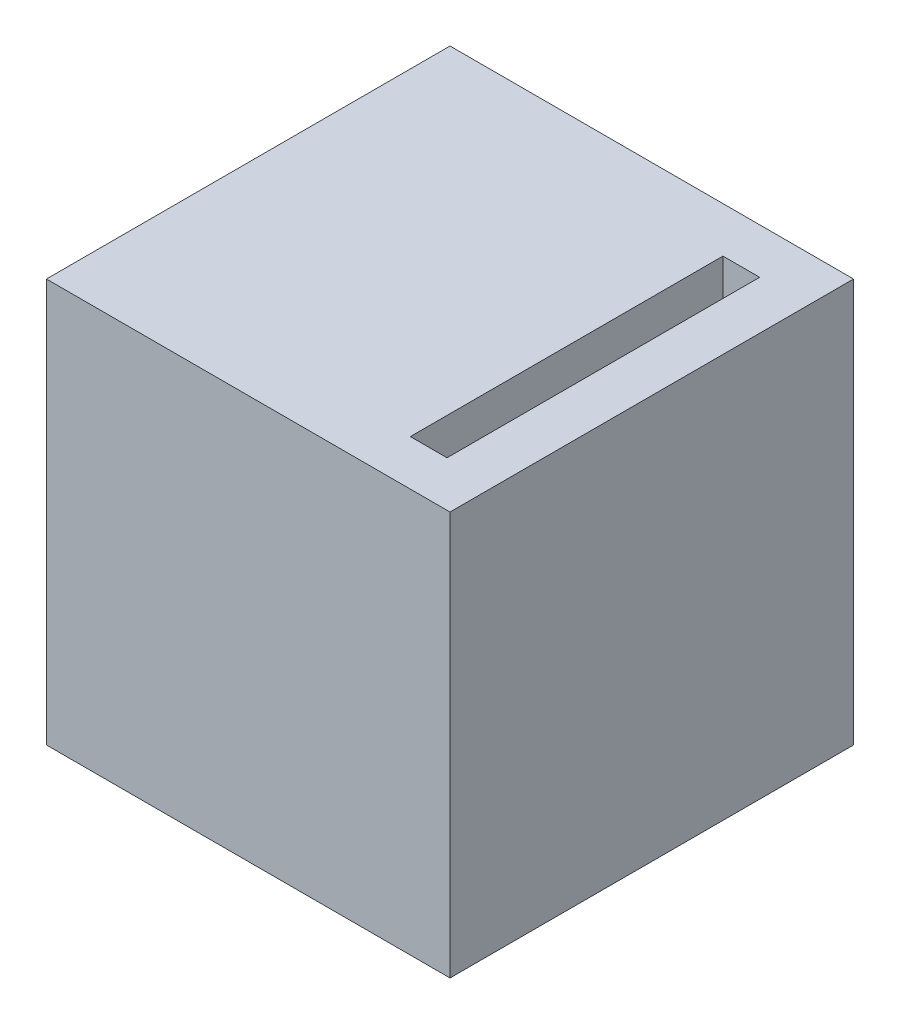
from build123d import *

# Parameters (mm, degrees)
SKETCH1_W           = 5
SKETCH1_H           = 5
BOSS_EXTRUDE1_DEPTH = 5
SKETCH2_W           = 0.454987437
SKETCH2_H           = 3.873436454
CUT_EXTRUDE1_DEPTH  = 4


with BuildPart() as part:
    # Sketch1 → Boss-Extrude1 (new body)
    with BuildSketch(Plane(origin=(0, 0, 0), x_dir=(1, 0, 0), z_dir=(0, 1, 0))):
        with Locations((-36.874660162, -27.610000121)):
            Rectangle(SKETCH1_W, SKETCH1_H)
    extrude(amount=BOSS_EXTRUDE1_DEPTH)

    # Sketch2 → Cut-Extrude1 (cut)
    with BuildSketch(Plane(origin=(0, 5, 0), x_dir=(1, 0, 0), z_dir=(0, 1, 0))):
        with Locations((-35.20215388, -27.610000121)):
            Rectangle(SKETCH2_W, SKETCH2_H)
    extrude(amount=-CUT_EXTRUDE1_DEPTH, mode=Mode.SUBTRACT)


solid = part.part
